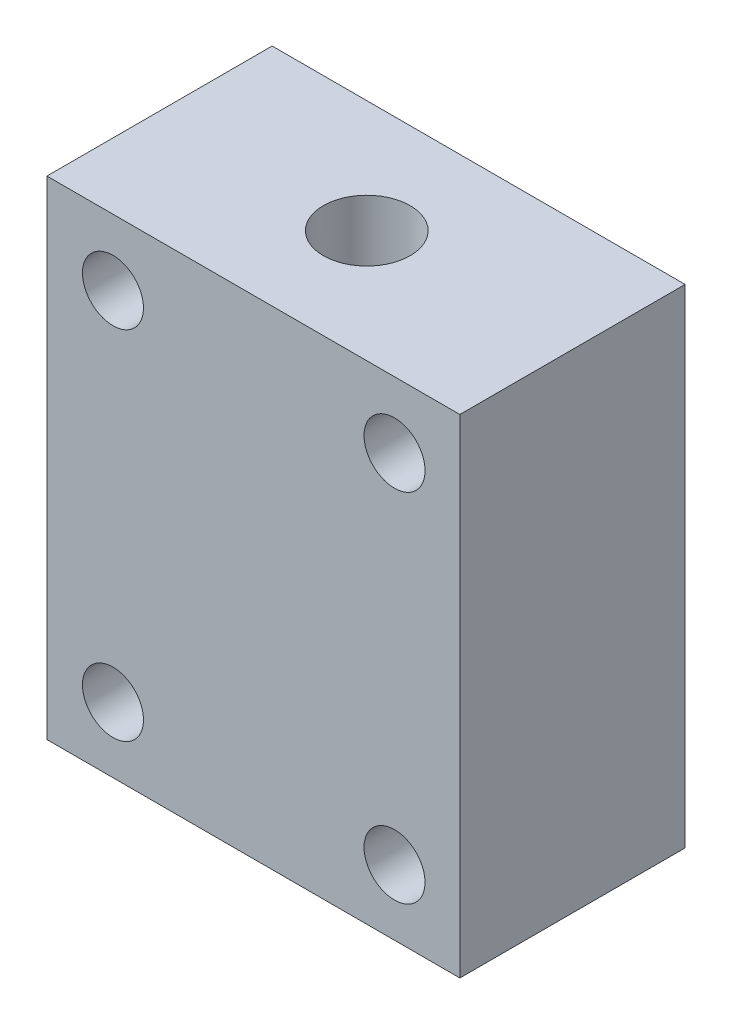
from build123d import *

# Parameters (mm, degrees)
SKETCH1_W           = 82.55
SKETCH1_H           = 69.85
BOSS_EXTRUDE1_DEPTH = 19.05
CUT_EXTRUDE2_START  = -19.05
SKETCH2_R           = 5.159375
CUT_EXTRUDE2_DEPTH  = 38.1
CUT_EXTRUDE4_START  = -19.05
SKETCH3_R           = 5.159375
CUT_EXTRUDE4_DEPTH  = 38.1
CUT_EXTRUDE6_START  = -19.05
SKETCH4_R           = 7.3421875
CUT_EXTRUDE6_DEPTH  = 28.448
CUT_EXTRUDE8_START  = -19.05
SKETCH5_R           = 12.7254
CUT_EXTRUDE8_DEPTH  = 2.8194
CUT_EXTRUDE10_START = -19.05
SKETCH6_R           = 7.3421875
CUT_EXTRUDE10_DEPTH = 28.448
CUT_EXTRUDE12_START = -19.05
SKETCH7_R           = 12.7254
CUT_EXTRUDE12_DEPTH = 2.8194
CUT_EXTRUDE14_START = 41.275
SKETCH8_R           = 7.3421875
CUT_EXTRUDE14_DEPTH = 60.452


with BuildPart() as part:
    # Sketch1 → Boss-Extrude1 (new, symmetric)
    with BuildSketch(Plane(origin=(0, 0, 0), x_dir=(0, 1, 0), z_dir=(0, 0, 1))):
        Rectangle(SKETCH1_W, SKETCH1_H)
    extrude(amount=BOSS_EXTRUDE1_DEPTH, both=True)

    # Sketch2 → Cut-Extrude2 (cut)
    with BuildSketch(Plane(origin=(0, 0, 0), x_dir=(0, 1, 0), z_dir=(0, 0, 1)).offset(CUT_EXTRUDE2_START)):
        with Locations(Location((-30.226, -23.876, 0), (0, 0, 90))):
            Circle(SKETCH2_R)
    extrude(amount=CUT_EXTRUDE2_DEPTH, mode=Mode.SUBTRACT)

    # Sketch3 → Cut-Extrude4 (cut)
    with BuildSketch(Plane(origin=(0, 0, 0), x_dir=(0, 1, 0), z_dir=(0, 0, 1)).offset(CUT_EXTRUDE4_START)):
        with Locations(Location((30.099, -23.876, 0), (0, 0, 90))):
            Circle(SKETCH3_R)
        with Locations(Location((-30.226, 23.749, 0), (0, 0, 90))):
            Circle(SKETCH3_R)
        with Locations(Location((30.099, 23.749, 0), (0, 0, 90))):
            Circle(SKETCH3_R)
    extrude(amount=CUT_EXTRUDE4_DEPTH, mode=Mode.SUBTRACT)

    # Sketch4 → Cut-Extrude6 (cut)
    with BuildSketch(Plane(origin=(0, 0, 0), x_dir=(0, 1, 0), z_dir=(0, 0, 1)).offset(CUT_EXTRUDE6_START)):
        with Locations(Location((-17.653, -0.127, 0), (0, 0, 270))):
            Circle(SKETCH4_R)
    extrude(amount=CUT_EXTRUDE6_DEPTH, mode=Mode.SUBTRACT)

    # Sketch5 → Cut-Extrude8 (cut)
    with BuildSketch(Plane(origin=(0, 0, 0), x_dir=(0, 1, 0), z_dir=(0, 0, 1)).offset(CUT_EXTRUDE8_START)):
        with Locations(Location((-17.653, -0.127, 0), (0, 0, 270))):
            Circle(SKETCH5_R)
    extrude(amount=CUT_EXTRUDE8_DEPTH, mode=Mode.SUBTRACT)

    # Sketch6 → Cut-Extrude10 (cut)
    with BuildSketch(Plane(origin=(0, 0, 0), x_dir=(0, 1, 0), z_dir=(0, 0, 1)).offset(CUT_EXTRUDE10_START)):
        with Locations(Location((17.399, -0.127, 0), (0, 0, 270))):
            Circle(SKETCH6_R)
    extrude(amount=CUT_EXTRUDE10_DEPTH, mode=Mode.SUBTRACT)

    # Sketch7 → Cut-Extrude12 (cut)
    with BuildSketch(Plane(origin=(0, 0, 0), x_dir=(0, 1, 0), z_dir=(0, 0, 1)).offset(CUT_EXTRUDE12_START)):
        with Locations(Location((17.399, -0.127, 0), (0, 0, 270))):
            Circle(SKETCH7_R)
    extrude(amount=CUT_EXTRUDE12_DEPTH, mode=Mode.SUBTRACT)

    # Sketch8 → Cut-Extrude14 (cut)
    with BuildSketch(Plane(origin=(0, 0, 0), x_dir=(-1, 0, 0), z_dir=(0, 1, 0)).offset(CUT_EXTRUDE14_START)):
        with Locations((-0.127, 0)):
            Circle(SKETCH8_R)
    extrude(amount=-CUT_EXTRUDE14_DEPTH, mode=Mode.SUBTRACT)


solid = part.part
